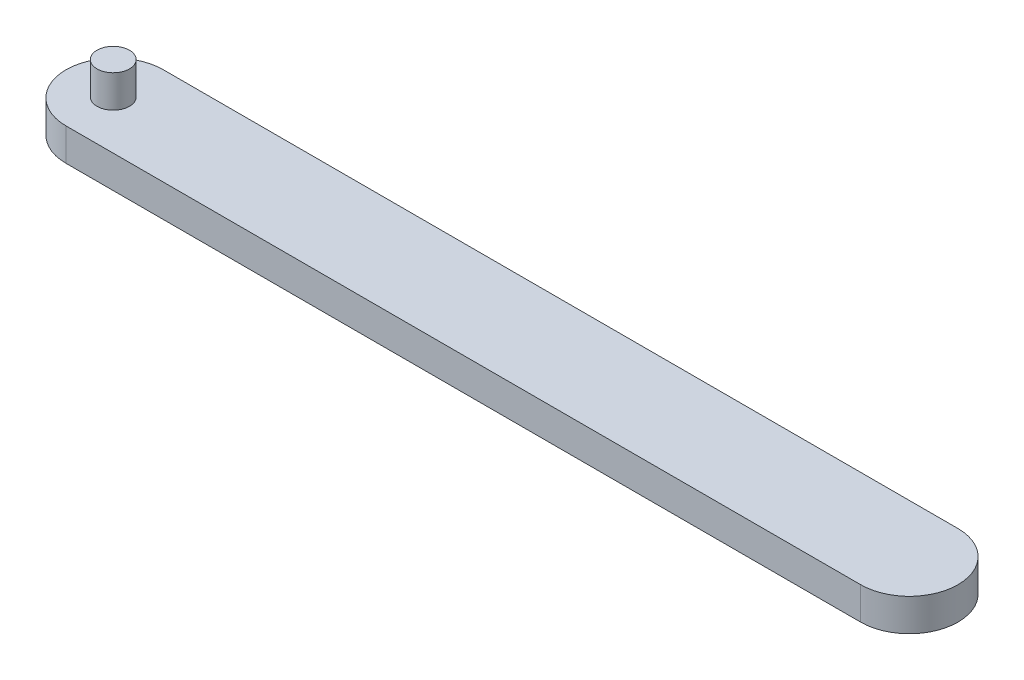
from build123d import *

# Parameters (mm, degrees)
SKETCH2_W           = 69.85
SKETCH2_H           = 7.62
BOSS_EXTRUDE1_DEPTH = 2.54
FILLET1_RADIUS      = 3.81
FILLET1_LENGTH      = 2.54
FILLET2_RADIUS      = 3.81
FILLET2_LENGTH      = 2.54
SKETCH3_R           = 1.27
BOSS_EXTRUDE2_DEPTH = 2.54


with BuildPart() as part:
    # Sketch2 → Boss-Extrude1 (new body)
    with BuildSketch(Plane(origin=(0, 0, 0), x_dir=(1, 0, 0), z_dir=(0, 1, 0))):
        Rectangle(SKETCH2_W, SKETCH2_H)
    extrude(amount=BOSS_EXTRUDE1_DEPTH)

    # Fillet1: full round fillet: the end face becomes a half cylinder, R = half its width
    fillet1_face = Plane((34.925, 1.27, 0), x_dir=(0, 1, 0), z_dir=(1, 0, 0))  # on the end face: x along it, z out of the body
    fillet1_slab = fillet1_face.offset(-FILLET1_RADIUS / 2) * Box(FILLET1_LENGTH, 2 * FILLET1_RADIUS, FILLET1_RADIUS, mode=Mode.PRIVATE)  # the body's end, R deep
    fillet1_round = Plane((31.115, 1.27, 0), x_dir=(1, 0, 0), z_dir=(0, 1, 0)) * Cylinder(FILLET1_RADIUS, FILLET1_LENGTH, mode=Mode.PRIVATE)  # its axis R under the face
    add(fillet1_slab - fillet1_round, mode=Mode.SUBTRACT)

    # Fillet2: full round fillet: the end face becomes a half cylinder, R = half its width
    fillet2_face = Plane((-34.925, 1.27, 0), x_dir=(0, -1, 0), z_dir=(-1, 0, 0))  # on the end face: x along it, z out of the body
    fillet2_slab = fillet2_face.offset(-FILLET2_RADIUS / 2) * Box(FILLET2_LENGTH, 2 * FILLET2_RADIUS, FILLET2_RADIUS, mode=Mode.PRIVATE)  # the body's end, R deep
    fillet2_round = Plane((-31.115, 1.27, 0), x_dir=(-1, 0, 0), z_dir=(0, -1, 0)) * Cylinder(FILLET2_RADIUS, FILLET2_LENGTH, mode=Mode.PRIVATE)  # its axis R under the face
    add(fillet2_slab - fillet2_round, mode=Mode.SUBTRACT)

    # Sketch3 → Boss-Extrude2 (add)
    with BuildSketch(Plane(origin=(0, 2.54, 0), x_dir=(1, 0, 0), z_dir=(0, 1, 0))):
        with Locations(Location((-31.227747573, 0, 0), (0, 0, 270))):
            Circle(SKETCH3_R)
    extrude(amount=BOSS_EXTRUDE2_DEPTH)


solid = part.part
